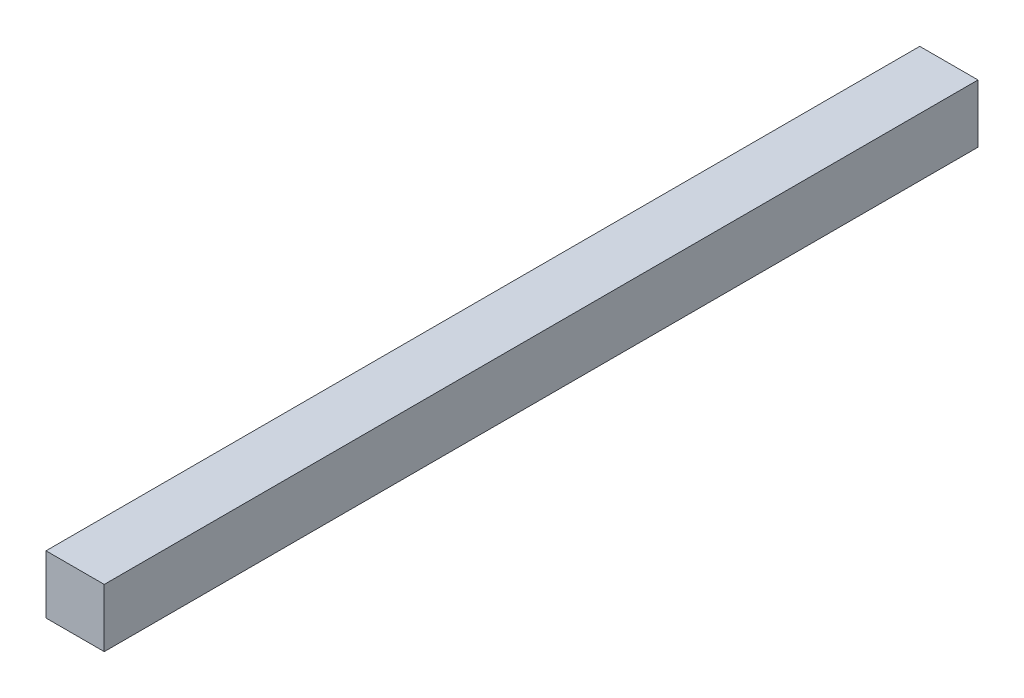
from build123d import *

# Parameters (mm, degrees)
SZKIC1_W                    = 10
SZKIC1_H                    = 10
DODANIE_WYCI_GNI_CIE1_DEPTH = 150


with BuildPart() as part:
    # Szkic1 → Dodanie-wyciągnięcie1 (new body)
    with BuildSketch(Plane.XY):
        Rectangle(SZKIC1_W, SZKIC1_H)
    extrude(amount=DODANIE_WYCI_GNI_CIE1_DEPTH)


solid = part.part
